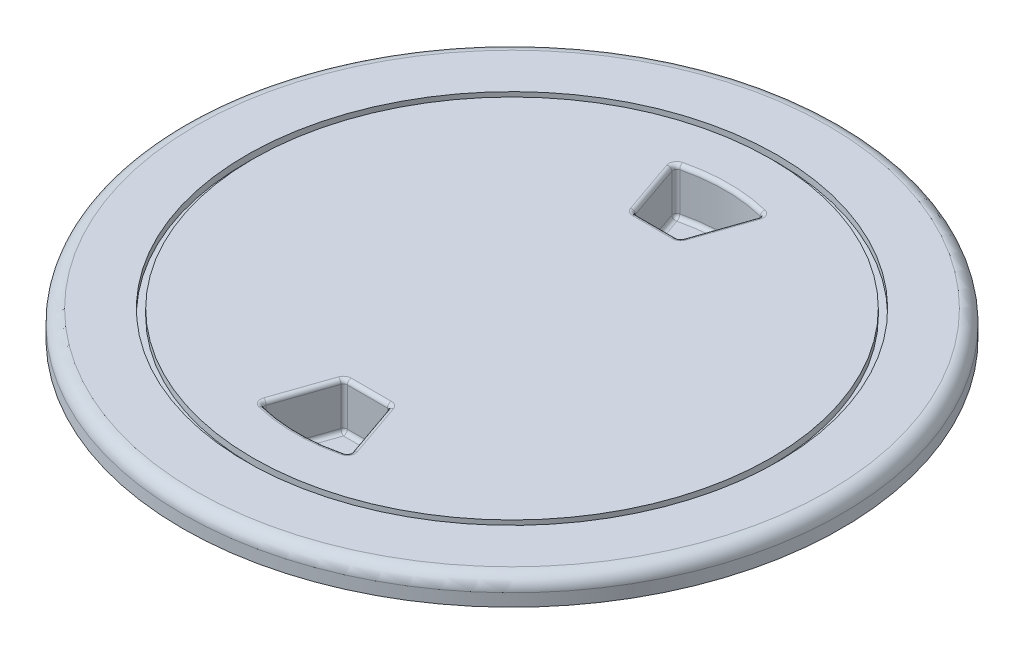
from build123d import *

# Parameters (mm, degrees)
CUT_EXTRUDE1_DEPTH = 17.5
CUT_EXTRUDE2_START = -17.5
SKETCH5_R          = 90
CUT_EXTRUDE2_DEPTH = 17.5
FILLET2_R          = 1.5
FILLET4_R          = 4.8


with BuildPart() as part:
    # Sketch2 → Revolve1 (revolve)
    with BuildSketch(Plane.XY, mode=Mode.PRIVATE) as revolve1_sk:
        with BuildLine():
            Line((0, 0), (98.25, 0))
            Line((98.25, 0), (98.25, -2.461366108))
            Line((98.25, -2.461366108), (100.75, -2.461366108))
            Line((100.75, -2.461366108), (100.75, 0))
            Line((100.75, 0), (120, 0))
            ThreePointArc((120, 0), (123.535533906, -1.464466094), (125, -5))
            Line((125, -5), (125, -9.75))
            Line((125, -9.75), (98.25, -9.75))
            Line((98.25, -9.75), (98.25, -27.9))
            Line((98.25, -27.9), (90, -27.9))
            Line((90, -27.9), (90, -20.8))
            Line((90, -20.8), (0, -20.8))
            Line((0, -20.8), (0, 0))
        make_face()
    revolve(revolve1_sk.sketch.rotate(Axis((0, -20.8, 0), (0, 1, 0)), 90), axis=Axis((0, -20.8, 0), (0, 1, 0)))

    # Sketch4 → Cut-Extrude1 (cut)
    with BuildSketch(Plane(origin=(0, 0, 0), x_dir=(1, 0, 0), z_dir=(0, 1, 0))):
        with BuildLine():
            Line((-7.606773544, 54.85), (7.606773544, 54.85))
            ThreePointArc((7.606773544, 54.85), (8.476902844, 55.12816736), (9.024310051, 55.8595))
            Line((9.024310051, 55.8595), (16.318959586, 76.940910854))
            ThreePointArc((16.318959586, 76.940910854), (16.218948226, 78.148437691), (15.259252683, 78.888105048))
            ThreePointArc((15.259252683, 78.888105048), (0, 80.734833862), (-15.259252683, 78.888105048))
            ThreePointArc((-15.259252683, 78.888105048), (-16.218948226, 78.148437691), (-16.318959586, 76.940910854))
            Line((-16.318959586, 76.940910854), (-9.024310051, 55.8595))
            ThreePointArc((-9.024310051, 55.8595), (-8.476902844, 55.12816736), (-7.606773544, 54.85))
        make_face()
        with BuildLine():
            Line((-16.318959586, -76.940910854), (-9.024310051, -55.8595))
            ThreePointArc((-9.024310051, -55.8595), (-8.476902844, -55.12816736), (-7.606773544, -54.85))
            Line((-7.606773544, -54.85), (7.606773544, -54.85))
            ThreePointArc((7.606773544, -54.85), (8.476902844, -55.12816736), (9.024310051, -55.8595))
            Line((9.024310051, -55.8595), (16.318959586, -76.940910854))
            ThreePointArc((16.318959586, -76.940910854), (16.218948226, -78.148437691), (15.259252683, -78.888105048))
            ThreePointArc((15.259252683, -78.888105048), (0, -80.734833862), (-15.259252683, -78.888105048))
            ThreePointArc((-15.259252683, -78.888105048), (-16.218948226, -78.148437691), (-16.318959586, -76.940910854))
        make_face()
    extrude(amount=-CUT_EXTRUDE1_DEPTH, mode=Mode.SUBTRACT)

    # Sketch5 → Cut-Extrude2 (cut)
    with BuildSketch(Plane.XZ.offset(20.8).offset(CUT_EXTRUDE2_START)):
        with Locations(Location((0, 0, 0), (0, 0, 270))):
            Circle(SKETCH5_R)
        with BuildLine():
            Line((-7.606773544, -51.55), (7.606773544, -51.55))
            ThreePointArc((7.606773544, -51.55), (10.391187306, -52.440135552), (12.142890368, -54.7804))
            Line((12.142890368, -54.7804), (19.437539902, -75.861810854))
            ThreePointArc((19.437539902, -75.861810854), (19.117503551, -79.725896732), (16.046477815, -82.092832274))
            ThreePointArc((16.046477815, -82.092832274), (0, -84.034833862), (-16.046477815, -82.092832274))
            ThreePointArc((-16.046477815, -82.092832274), (-19.117503551, -79.725896732), (-19.437539902, -75.861810854))
            Line((-19.437539902, -75.861810854), (-12.142890368, -54.7804))
            ThreePointArc((-12.142890368, -54.7804), (-10.391187306, -52.440135552), (-7.606773544, -51.55))
        make_face(mode=Mode.SUBTRACT)
        with BuildLine():
            Line((-12.142890368, 54.7804), (-19.437539902, 75.861810854))
            ThreePointArc((-19.437539902, 75.861810854), (-19.117503551, 79.725896732), (-16.046477815, 82.092832274))
            ThreePointArc((-16.046477815, 82.092832274), (0, 84.034833862), (16.046477815, 82.092832274))
            ThreePointArc((16.046477815, 82.092832274), (19.117503551, 79.725896732), (19.437539902, 75.861810854))
            Line((19.437539902, 75.861810854), (12.142890368, 54.7804))
            ThreePointArc((12.142890368, 54.7804), (10.391187306, 52.440135552), (7.606773544, 51.55))
            Line((7.606773544, 51.55), (-7.606773544, 51.55))
            ThreePointArc((-7.606773544, 51.55), (-10.391187306, 52.440135552), (-12.142890368, 54.7804))
        make_face(mode=Mode.SUBTRACT)
    extrude(amount=CUT_EXTRUDE2_DEPTH, mode=Mode.SUBTRACT)

    # Fillet2
    fillet2_edges = [part.edges().sort_by_distance(p)[0] for p in [
        (8.476902844, -17.5, -55.12816736),
        (0, -17.5, -54.85),
        (-8.476902844, -17.5, -55.12816736),
        (-12.671634818, -17.5, -66.400205427),
        (-16.218948226, -17.5, -78.148437691),
        (0, -17.5, -80.734833862),
        (16.218948226, -17.5, -78.148437691),
        (12.671634818, -17.5, -66.400205427),
        (8.476902844, 0, -55.12816736),
        (12.671634818, 0, -66.400205427),
        (16.218948226, 0, -78.148437691),
        (0, 0, -80.734833862),
        (-16.218948226, 0, -78.148437691),
        (-12.671634818, 0, -66.400205427),
        (-8.476902844, 0, -55.12816736),
        (0, 0, -54.85),
        (-16.218948226, -17.5, 78.148437691),
        (-12.671634818, -17.5, 66.400205427),
        (-8.476902844, -17.5, 55.12816736),
        (0, -17.5, 54.85),
        (8.476902844, -17.5, 55.12816736),
        (12.671634818, -17.5, 66.400205427),
        (16.218948226, -17.5, 78.148437691),
        (0, -17.5, 80.734833862),
        (-16.218948226, 0, 78.148437691),
        (0, 0, 80.734833862),
        (16.218948226, 0, 78.148437691),
        (12.671634818, 0, 66.400205427),
        (8.476902844, 0, 55.12816736),
        (0, 0, 54.85),
        (-8.476902844, 0, 55.12816736),
        (-12.671634818, 0, 66.400205427),
    ]]
    fillet(fillet2_edges, radius=FILLET2_R)

    # Fillet4
    fillet4_edges = [part.edges().sort_by_distance(p)[0] for p in [
        (10.391187306, -20.8, -52.440135552),
        (15.790215135, -20.8, -65.321105427),
        (19.117503551, -20.8, -79.725896732),
        (0, -20.8, -84.034833862),
        (-19.117503551, -20.8, -79.725896732),
        (-15.790215135, -20.8, -65.321105427),
        (-10.391187306, -20.8, -52.440135552),
        (0, -20.8, -51.55),
        (0, -20.8, 84.034833862),
        (19.117503551, -20.8, 79.725896732),
        (15.790215135, -20.8, 65.321105427),
        (10.391187306, -20.8, 52.440135552),
        (0, -20.8, 51.55),
        (-10.391187306, -20.8, 52.440135552),
        (-15.790215135, -20.8, 65.321105427),
        (-19.117503551, -20.8, 79.725896732),
    ]]
    fillet(fillet4_edges, radius=FILLET4_R)


solid = part.part
